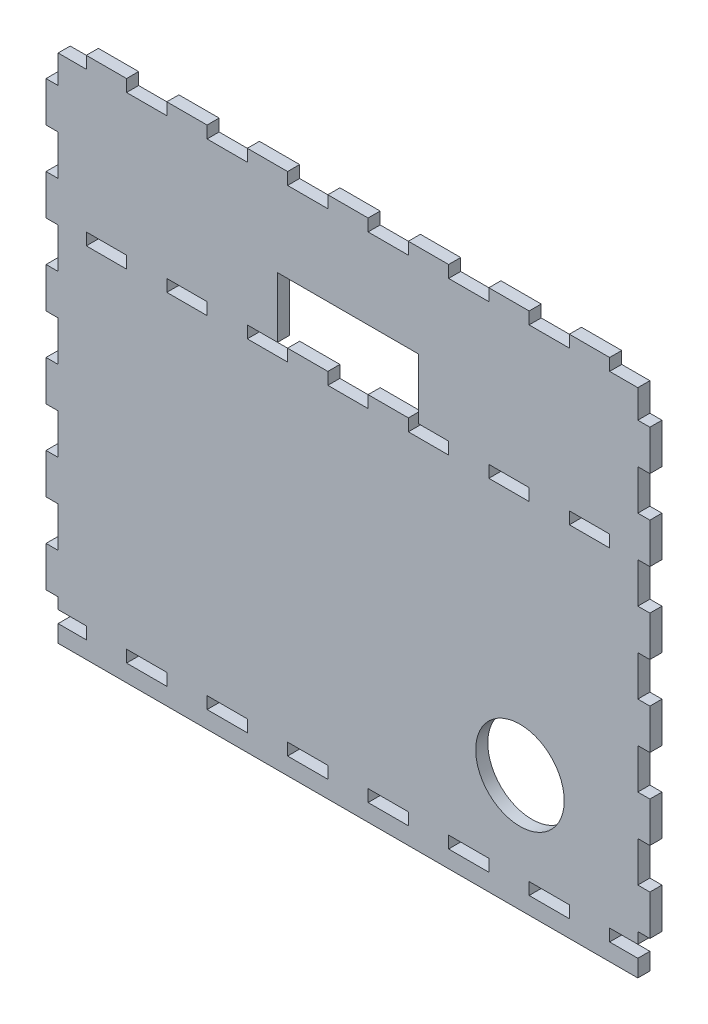
from build123d import *

# Parameters (mm, degrees)
CROQUIS1_W              = 10
CROQUIS1_H              = 3
CROQUIS1_R              = 11
SALIENTE_EXTRUIR1_DEPTH = 3


with BuildPart() as part:
    # Croquis1 → Saliente-Extruir1 (new body)
    with BuildSketch(Plane.XY):
        Polygon((-35, 71.5), (-45, 71.5), (-45, 68.5), (-55, 68.5), (-55, 71.5), (-65, 71.5), (-65, 68.5), (-72, 68.5), (-72, 61.5), (-75, 61.5), (-75, 51.5), (-72, 51.5), (-72, 41.5), (-75, 41.5), (-75, 31.5), (-72, 31.5), (-72, 21.5), (-75, 21.5), (-75, 11.5), (-72, 11.5), (-72, 1.5), (-75, 1.5), (-75, -8.5), (-72, -8.5), (-72, -18.5), (-75, -18.5), (-75, -28.5), (-72, -28.5), (-72, -38.5), (-75, -38.5), (-75, -48.5), (-72, -48.5), (-72, -51.25), (-65, -51.25), (-65, -54.25), (-72, -54.25), (-72, -58.5), (72, -58.5), (72, -54.25), (65, -54.25), (65, -51.25), (72, -51.25), (72, -48.5), (75, -48.5), (75, -38.5), (72, -38.5), (72, -28.5), (75, -28.5), (75, -18.5), (72, -18.5), (72, -8.5), (75, -8.5), (75, 1.5), (72, 1.5), (72, 11.5), (75, 11.5), (75, 21.5), (72, 21.5), (72, 31.5), (75, 31.5), (75, 41.5), (72, 41.5), (72, 51.5), (75, 51.5), (75, 61.5), (72, 61.5), (72, 68.5), (65, 68.5), (65, 71.5), (55, 71.5), (55, 68.5), (45, 68.5), (45, 71.5), (35, 71.5), (35, 68.5), (25, 68.5), (25, 71.5), (15, 71.5), (15, 68.5), (5, 68.5), (5, 71.5), (-5, 71.5), (-5, 68.5), (-15, 68.5), (-15, 71.5), (-25, 71.5), (-25, 68.5), (-35, 68.5), align=None)
        with Locations((-50, -52.75)):
            Rectangle(CROQUIS1_W, CROQUIS1_H, mode=Mode.SUBTRACT)
        with Locations((-30, -52.75)):
            Rectangle(CROQUIS1_W, CROQUIS1_H, mode=Mode.SUBTRACT)
        with Locations((-10, -52.75)):
            Rectangle(CROQUIS1_W, CROQUIS1_H, mode=Mode.SUBTRACT)
        with Locations((10, -52.75)):
            Rectangle(CROQUIS1_W, CROQUIS1_H, mode=Mode.SUBTRACT)
        with Locations((30, -52.75)):
            Rectangle(CROQUIS1_W, CROQUIS1_H, mode=Mode.SUBTRACT)
        with Locations((50, -52.75)):
            Rectangle(CROQUIS1_W, CROQUIS1_H, mode=Mode.SUBTRACT)
        with Locations((42.725871833, -29.529627422)):
            Circle(CROQUIS1_R, mode=Mode.SUBTRACT)
        with Locations((-60, 32)):
            Rectangle(CROQUIS1_W, CROQUIS1_H, mode=Mode.SUBTRACT)
        with Locations((-40, 32)):
            Rectangle(CROQUIS1_W, CROQUIS1_H, mode=Mode.SUBTRACT)
        Polygon((-25, 30.5), (-25, 33.5), (-17.5, 33.5), (-17.5, 48.5), (17.5, 48.5), (17.5, 33.5), (25, 33.5), (25, 30.5), (15, 30.5), (15, 33.5), (5, 33.5), (5, 30.5), (-5, 30.5), (-5, 33.5), (-15, 33.5), (-15, 30.5), align=None, mode=Mode.SUBTRACT)
        with Locations((40, 32)):
            Rectangle(CROQUIS1_W, CROQUIS1_H, mode=Mode.SUBTRACT)
        with Locations((60, 32)):
            Rectangle(CROQUIS1_W, CROQUIS1_H, mode=Mode.SUBTRACT)
    extrude(amount=SALIENTE_EXTRUIR1_DEPTH)


solid = part.part
